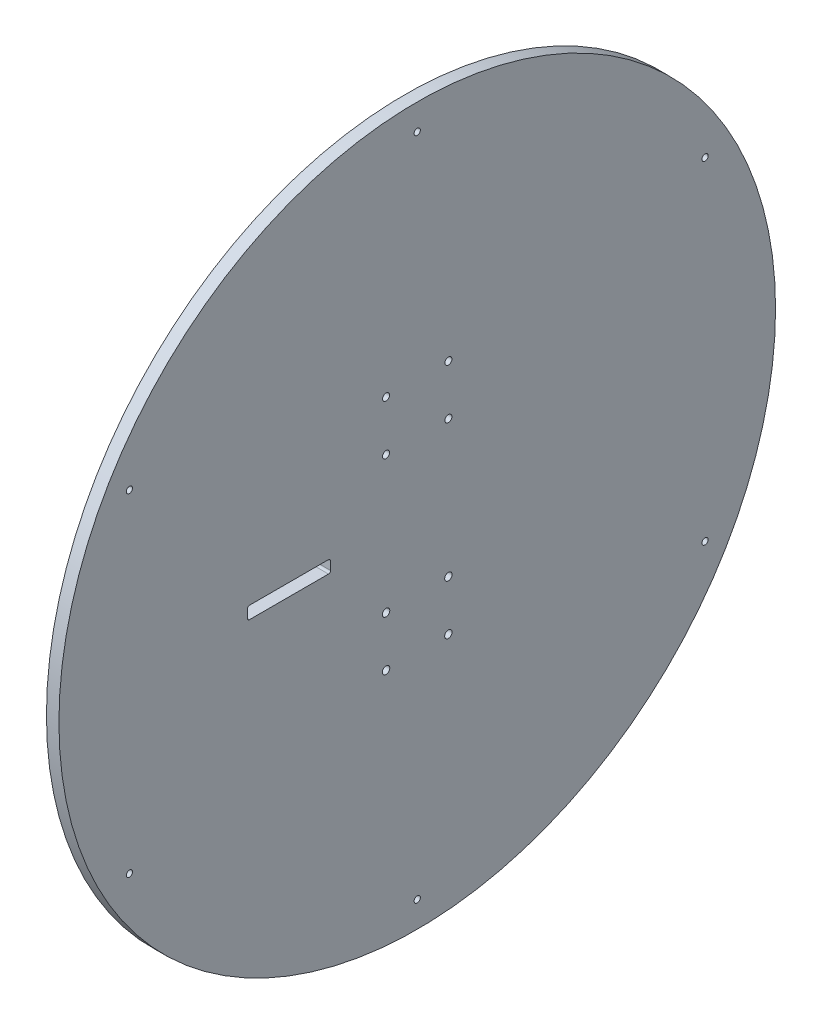
from build123d import *

# Parameters (mm, degrees)
SKETCH_1_R      = 1.5
SKETCH_1_R_2    = 1.785756588
SKETCH_1_R_3    = 1.689732538
EXTRUDE_1_DEPTH = 6


with BuildPart() as part:
    # 草图1 → 凸台-拉伸1 (new body)
    # profile 1 of 2: a face of its own
    with BuildSketch(Plane(origin=(0, 0, 0), x_dir=(0, 0, -1), z_dir=(1, 0, 0))):
        with BuildLine():
            ThreePointArc((-172.5, 0), (0, -172.5), (172.5, 0))
            Line((172.5, 0), (-41.730591699, 0))
            Line((-41.730591699, 0), (-41.730591699, -2))
            ThreePointArc((-41.730591699, -2), (-42.023484918, -2.707106781), (-42.730591699, -3))
            Line((-42.730591699, -3), (-80.730591699, -3))
            ThreePointArc((-80.730591699, -3), (-81.43769848, -2.707106781), (-81.730591699, -2))
            Line((-81.730591699, -2), (-81.730591699, 0))
            Line((-81.730591699, 0), (-172.5, 0))
        make_face()
        with Locations((-138.564064605, -80)):
            Circle(SKETCH_1_R, mode=Mode.SUBTRACT)
        with Locations((-15, -56.936329309)):
            Circle(SKETCH_1_R_2, mode=Mode.SUBTRACT)
        with Locations((-15, -32.936329309)):
            Circle(SKETCH_1_R_2, mode=Mode.SUBTRACT)
        with Locations((0, -160)):
            Circle(SKETCH_1_R, mode=Mode.SUBTRACT)
        with Locations((15, -56.936329309)):
            Circle(SKETCH_1_R_2, mode=Mode.SUBTRACT)
        with Locations((15, -32.936329309)):
            Circle(SKETCH_1_R_2, mode=Mode.SUBTRACT)
        with Locations((138.564064606, -80)):
            Circle(SKETCH_1_R, mode=Mode.SUBTRACT)
    # profile 2 of 2: a face of its own
    with BuildSketch(Plane(origin=(0, 0, 0), x_dir=(0, 0, -1), z_dir=(1, 0, 0))):
        with BuildLine():
            Line((-41.730591699, 0), (172.5, 0))
            ThreePointArc((172.5, 0), (0, 172.5), (-172.5, 0))
            Line((-172.5, 0), (-81.730591699, 0))
            Line((-81.730591699, 0), (-81.730591699, 2))
            ThreePointArc((-81.730591699, 2), (-81.43769848, 2.707106781), (-80.730591699, 3))
            Line((-80.730591699, 3), (-42.730591699, 3))
            ThreePointArc((-42.730591699, 3), (-42.023484918, 2.707106781), (-41.730591699, 2))
            Line((-41.730591699, 2), (-41.730591699, 0))
        make_face()
        with Locations((-138.564064605, 80)):
            Circle(SKETCH_1_R, mode=Mode.SUBTRACT)
        with Locations((-15, 32.936329309)):
            Circle(SKETCH_1_R_3, mode=Mode.SUBTRACT)
        with Locations((-15, 56.936329309)):
            Circle(SKETCH_1_R_3, mode=Mode.SUBTRACT)
        with Locations((0, 160)):
            Circle(SKETCH_1_R, mode=Mode.SUBTRACT)
        with Locations((15, 32.936329309)):
            Circle(SKETCH_1_R_3, mode=Mode.SUBTRACT)
        with Locations((15, 56.936329309)):
            Circle(SKETCH_1_R_3, mode=Mode.SUBTRACT)
        with Locations((138.564064606, 80)):
            Circle(SKETCH_1_R, mode=Mode.SUBTRACT)
    extrude(amount=-EXTRUDE_1_DEPTH)


solid = part.part
